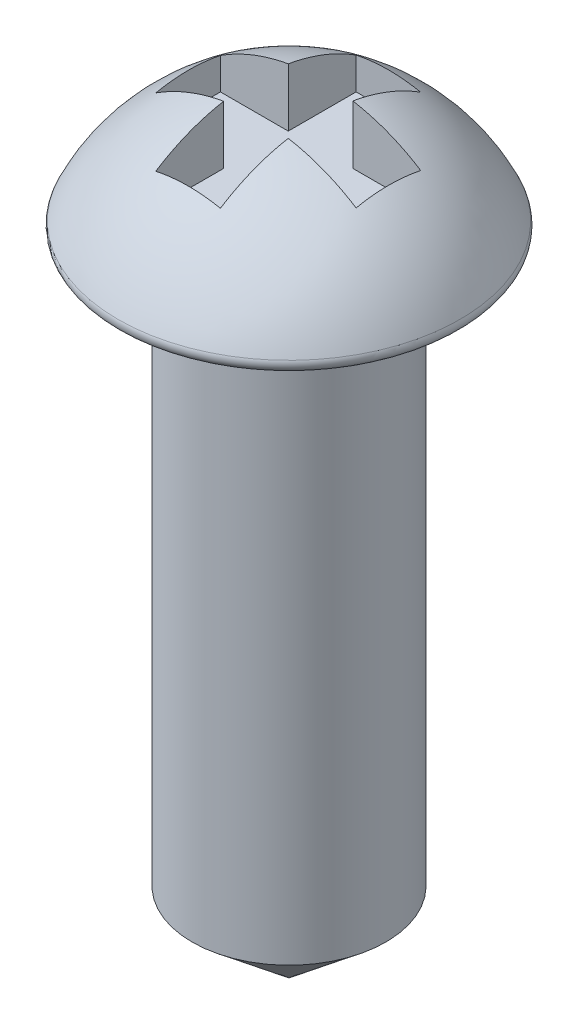
from build123d import *

# Parameters (mm, degrees)
CONG_1_R                = 0.1
ENL_V_MAT_EXTRU_1_DEPTH = 0.5


with BuildPart() as part:
    # Esquisse1 → Révolution1 (revolve)
    with BuildSketch(Plane.XY, mode=Mode.PRIVATE) as r_volution1_sk:
        with BuildLine():
            Line((2, 0), (1.1, 0))
            Line((1.1, 0), (1.1, -6.4))
            Line((1.1, -6.4), (0, -7.302889311))
            Line((0, -7.302889311), (0, 1.382388101))
            ThreePointArc((0, 1.382388101), (1.215627087, 1.003157221), (2, 0))
        make_face()
    revolve(r_volution1_sk.sketch.rotate(Axis((0, 3.800054794, 0), (0, -1, 0)), 90), axis=Axis((0, 3.800054794, 0), (0, -1, 0)))

    # Congé1
    cong_1_edges = [part.edges().sort_by_distance(p)[0] for p in [
        (0, 0, -2),
    ]]
    fillet(cong_1_edges, radius=CONG_1_R)

    # Esquisse2 → Enlèv. mat.-Extru.1 (cut, symmetric)
    with BuildSketch(Plane(origin=(0, 1.15653742, 0), x_dir=(-1, 0, 0), z_dir=(0, 1, 0))):
        Polygon((-0.361948003, 1.140760916), (0.37159995, 1.140760916), (0.37159995, 0.37038863), (1.141972235, 0.37038863), (1.141972235, -0.363159322), (0.37159995, -0.363159322), (0.37159995, -1.133531608), (-0.361948003, -1.133531608), (-0.361948003, -0.363159322), (-1.132320288, -0.363159322), (-1.132320288, 0.37038863), (-0.361948003, 0.37038863), align=None)
    extrude(amount=ENL_V_MAT_EXTRU_1_DEPTH, both=True, mode=Mode.SUBTRACT)


solid = part.part
